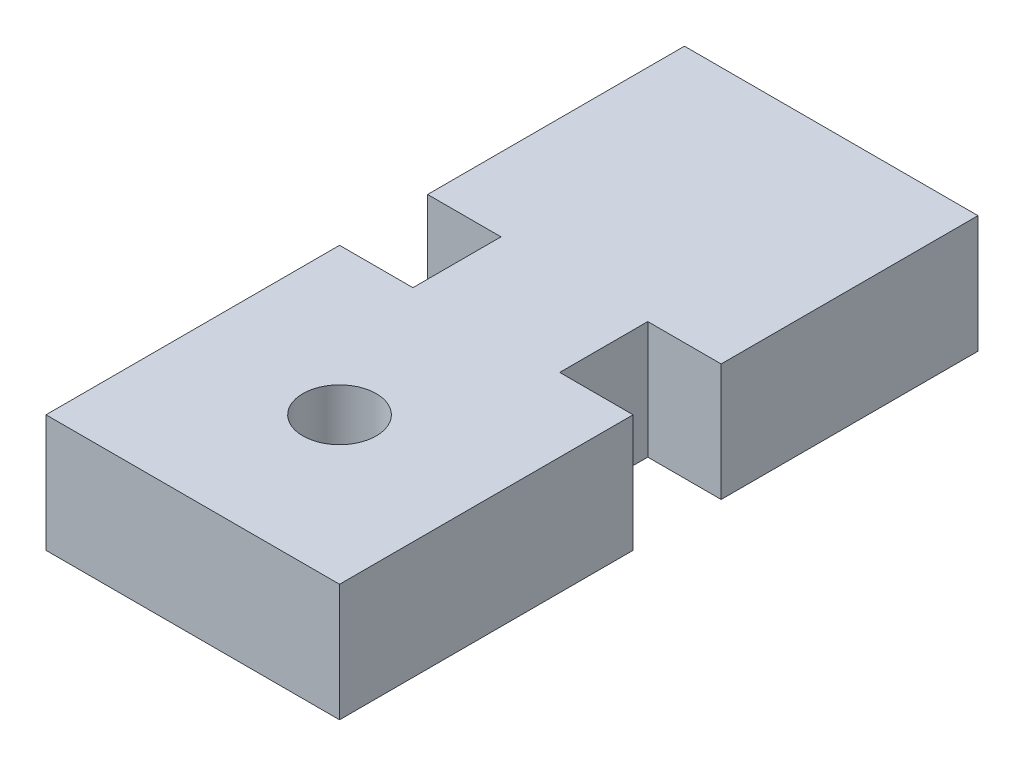
from build123d import *

# Parameters (mm, degrees)
SKETCH1_W           = 10
SKETCH1_H           = 10
SKETCH1_R           = 1.25
BOSS_EXTRUDE1_DEPTH = 2
SKETCH2_W           = 5
SKETCH2_H           = 3
BOSS_EXTRUDE2_DEPTH = 2
SKETCH3_W           = 10
SKETCH3_H           = 8.75
BOSS_EXTRUDE3_DEPTH = 2


with BuildPart() as part:
    # Sketch1 → Boss-Extrude1 (new, symmetric)
    with BuildSketch(Plane(origin=(0, 0, 0), x_dir=(1, 0, 0), z_dir=(0, 1, 0))):
        Rectangle(SKETCH1_W, SKETCH1_H)
        with Locations(Location((0, 0, 0), (0, 0, 270))):
            Circle(SKETCH1_R, mode=Mode.SUBTRACT)
    extrude(amount=BOSS_EXTRUDE1_DEPTH, both=True)

    # Sketch2 → Boss-Extrude2 (add, symmetric)
    with BuildSketch(Plane(origin=(0, 0, 0), x_dir=(1, 0, 0), z_dir=(0, 1, 0))):
        with Locations((0, 6.5)):
            Rectangle(SKETCH2_W, SKETCH2_H)
    extrude(amount=BOSS_EXTRUDE2_DEPTH, both=True)

    # Sketch3 → Boss-Extrude3 (add, symmetric)
    with BuildSketch(Plane(origin=(0, 0, 0), x_dir=(1, 0, 0), z_dir=(0, 1, 0))):
        with Locations((0, 12.375)):
            Rectangle(SKETCH3_W, SKETCH3_H)
    extrude(amount=BOSS_EXTRUDE3_DEPTH, both=True)


solid = part.part
